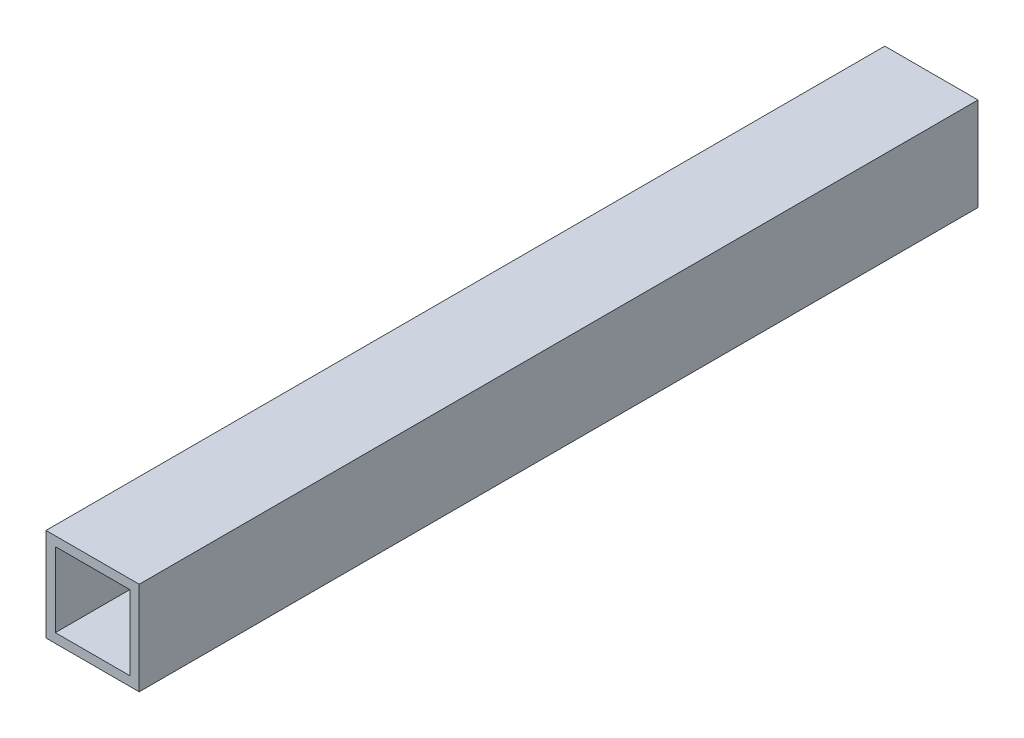
from build123d import *

# Parameters (mm, degrees)
SKETCH2_W           = 25.4
SKETCH2_H           = 25.4
SKETCH2_W_2         = 20.32
SKETCH2_H_2         = 20.32
BOSS_EXTRUDE1_DEPTH = 228.6


with BuildPart() as part:
    # Sketch2 → Boss-Extrude1 (new body)
    with BuildSketch(Plane.XY):
        Rectangle(SKETCH2_W, SKETCH2_H)
        Rectangle(SKETCH2_W_2, SKETCH2_H_2, mode=Mode.SUBTRACT)
    extrude(amount=BOSS_EXTRUDE1_DEPTH)


solid = part.part
